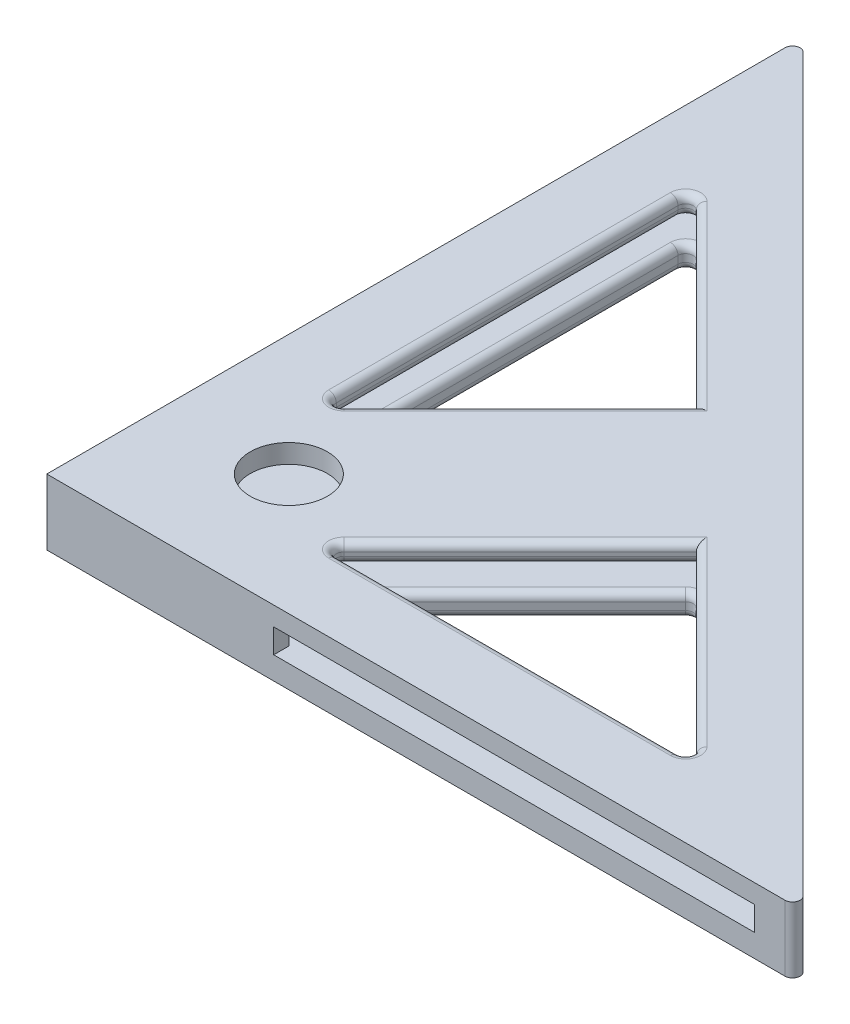
from build123d import *

# Parameters (mm, degrees)
BOSS_EXTRUDE1_DEPTH      = 3.1
BOSS_EXTRUDE2_DEPTH      = 3
BOSS_EXTRUDE4_DEPTH      = 3.2
BOSS_EXTRUDE4_DEPTH_BACK = 3
BOSS_EXTRUDE5_DEPTH      = 2.5
BOSS_EXTRUDE6_DEPTH      = 2.5
CUT_EXTRUDE1_START       = -3
SKETCH7_R                = 5.1
CUT_EXTRUDE1_DEPTH       = 10
BOSS_EXTRUDE7_DEPTH      = 3
FILLET1_R                = 1
CUT_EXTRUDE3_DEPTH       = 137.869712806
FILLET2_R                = 1
FILLET2_OF_MIRROR1_R     = 1
SKETCH20_W               = 4
SKETCH20_H               = 3.2
BOSS_EXTRUDE8_DEPTH      = 2
BOSS_EXTRUDE9_DEPTH      = 3.2
SKETCH22_W               = 4
SKETCH22_H               = 3.2
BOSS_EXTRUDE10_DEPTH     = 2
BOSS_EXTRUDE11_DEPTH     = 3.2


with BuildPart() as part:
    # Sketch1 → Boss-Extrude1 (new body)
    with BuildSketch(Plane(origin=(0, 0, 0), x_dir=(1, 0, 0), z_dir=(0, 1, 0))):
        with BuildLine():
            ThreePointArc((20.6, 14), (16.525710654, 20.097604915), (9.333095244, 18.666904756))
            Line((9.333095244, 18.666904756), (10.393755416, 17.606244584))
            ThreePointArc((10.393755416, 17.606244584), (15.951685505, 18.711785616), (19.1, 14))
            ThreePointArc((19.1, 14), (18.711785616, 12.048314495), (17.606244584, 10.393755416))
            Line((17.606244584, 10.393755416), (18.666904756, 9.333095244))
            ThreePointArc((18.666904756, 9.333095244), (20.097604915, 11.474289346), (20.6, 14))
        make_face()
        with BuildLine():
            Line((10.393755416, 17.606244584), (9.333095244, 18.666904756))
            ThreePointArc((9.333095244, 18.666904756), (9.333095244, 9.333095244), (18.666904756, 9.333095244))
            Line((18.666904756, 9.333095244), (17.606244584, 10.393755416))
            ThreePointArc((17.606244584, 10.393755416), (10.393755416, 10.393755416), (10.393755416, 17.606244584))
        make_face()
    extrude(amount=BOSS_EXTRUDE1_DEPTH)

    # Sketch2 → Boss-Extrude2 (add)
    with BuildSketch(Plane(origin=(0, 3.1, 0), x_dir=(1, 0, 0), z_dir=(0, 1, 0))):
        with BuildLine():
            Line((16.844257653, 19.955686224), (0, 28))
            Line((0, 28), (4.242424242, 23.757575758))
            Line((4.242424242, 23.757575758), (8.980990355, 21.494578276))
            Line((8.980990355, 21.494578276), (7.411542732, 20.588457268))
            Line((7.411542732, 20.588457268), (9.333095244, 18.666904756))
            ThreePointArc((9.333095244, 18.666904756), (12.883868272, 20.504940428), (16.844257653, 19.955686224))
        make_face()
        with BuildLine():
            Line((0, 28), (0, 0))
            Line((0, 0), (9.333095244, 9.333095244))
            ThreePointArc((9.333095244, 9.333095244), (7.4, 14), (9.333095244, 18.666904756))
            Line((9.333095244, 18.666904756), (7.411542732, 20.588457268))
            Line((7.411542732, 20.588457268), (4, 18.618802154))
            Line((4, 18.618802154), (4, 23.873350327))
            Line((4, 23.873350327), (4.242424242, 23.757575758))
            Line((4.242424242, 23.757575758), (0, 28))
        make_face()
        with BuildLine():
            Line((9.333095244, 9.333095244), (0, 0))
            Line((0, 0), (28, 0))
            Line((28, 0), (23.757575758, 4.242424242))
            Line((23.757575758, 4.242424242), (23.873350327, 4))
            Line((23.873350327, 4), (18.618802154, 4))
            Line((18.618802154, 4), (20.588457268, 7.411542732))
            Line((20.588457268, 7.411542732), (18.666904756, 9.333095244))
            ThreePointArc((18.666904756, 9.333095244), (14, 7.4), (9.333095244, 9.333095244))
        make_face()
        with BuildLine():
            Line((23.757575758, 4.242424242), (28, 0))
            Line((28, 0), (19.955686224, 16.844257653))
            ThreePointArc((19.955686224, 16.844257653), (20.436906442, 15.458161671), (20.6, 14))
            ThreePointArc((20.6, 14), (20.097604915, 11.474289346), (18.666904756, 9.333095244))
            Line((18.666904756, 9.333095244), (20.588457268, 7.411542732))
            Line((20.588457268, 7.411542732), (21.494578276, 8.980990355))
            Line((21.494578276, 8.980990355), (23.757575758, 4.242424242))
        make_face()
        with BuildLine():
            ThreePointArc((9.333095244, 18.666904756), (7.4, 14), (9.333095244, 9.333095244))
            Line((9.333095244, 9.333095244), (10.393755416, 10.393755416))
            ThreePointArc((10.393755416, 10.393755416), (8.9, 14), (10.393755416, 17.606244584))
            Line((10.393755416, 17.606244584), (9.333095244, 18.666904756))
        make_face()
        with BuildLine():
            Line((10.393755416, 10.393755416), (9.333095244, 9.333095244))
            ThreePointArc((9.333095244, 9.333095244), (14, 7.4), (18.666904756, 9.333095244))
            Line((18.666904756, 9.333095244), (17.606244584, 10.393755416))
            ThreePointArc((17.606244584, 10.393755416), (14, 8.9), (10.393755416, 10.393755416))
        make_face()
        with BuildLine():
            ThreePointArc((18.666904756, 18.666904756), (17.810463174, 19.388911801), (16.844257653, 19.955686224))
            ThreePointArc((16.844257653, 19.955686224), (12.883868272, 20.504940428), (9.333095244, 18.666904756))
            Line((9.333095244, 18.666904756), (10.393755416, 17.606244584))
            ThreePointArc((10.393755416, 17.606244584), (14, 19.1), (17.606244584, 17.606244584))
            Line((17.606244584, 17.606244584), (18.666904756, 18.666904756))
        make_face()
        with BuildLine():
            ThreePointArc((20.6, 14), (20.436906442, 15.458161671), (19.955686224, 16.844257653))
            ThreePointArc((19.955686224, 16.844257653), (19.388911801, 17.810463174), (18.666904756, 18.666904756))
            Line((18.666904756, 18.666904756), (17.606244584, 17.606244584))
            ThreePointArc((17.606244584, 17.606244584), (18.711785616, 15.951685505), (19.1, 14))
            ThreePointArc((19.1, 14), (18.711785616, 12.048314495), (17.606244584, 10.393755416))
            Line((17.606244584, 10.393755416), (18.666904756, 9.333095244))
            ThreePointArc((18.666904756, 9.333095244), (20.097604915, 11.474289346), (20.6, 14))
        make_face()
        with BuildLine():
            ThreePointArc((10.393755416, 17.606244584), (8.9, 14), (10.393755416, 10.393755416))
            Line((10.393755416, 10.393755416), (14, 14))
            Line((14, 14), (10.393755416, 17.606244584))
        make_face()
        with BuildLine():
            Line((14, 14), (10.393755416, 10.393755416))
            ThreePointArc((10.393755416, 10.393755416), (14, 8.9), (17.606244584, 10.393755416))
            Line((17.606244584, 10.393755416), (14, 14))
        make_face()
        with BuildLine():
            Line((17.606244584, 17.606244584), (14, 14))
            Line((14, 14), (17.606244584, 10.393755416))
            ThreePointArc((17.606244584, 10.393755416), (18.711785616, 12.048314495), (19.1, 14))
            ThreePointArc((19.1, 14), (18.711785616, 15.951685505), (17.606244584, 17.606244584))
        make_face()
        with BuildLine():
            Line((10.393755416, 17.606244584), (14, 14))
            Line((14, 14), (17.606244584, 17.606244584))
            ThreePointArc((17.606244584, 17.606244584), (14, 19.1), (10.393755416, 17.606244584))
        make_face()
    extrude(amount=BOSS_EXTRUDE2_DEPTH)

    # Sketch4 → Boss-Extrude4 (add, two sides: drawn at the far end of the back side and taken through both)
    with BuildSketch(Plane(origin=(0, 6.1, 0), x_dir=(1, 0, 0), z_dir=(0, 1, 0)).offset(-BOSS_EXTRUDE4_DEPTH_BACK)):
        Polygon((0, 28), (-2, 28), (-2, -2), (28, -2), (28, 0), (0, 0), align=None)
    extrude(amount=BOSS_EXTRUDE4_DEPTH + BOSS_EXTRUDE4_DEPTH_BACK)

    # Sketch5 → Boss-Extrude5 (add)
    with BuildSketch(Plane(origin=(0, 9.3, 0), x_dir=(1, 0, 0), z_dir=(0, 1, 0))):
        with BuildLine():
            Line((-2, 28), (0, 28))
            Line((0, 28), (15.695653699, 20.504225127))
            ThreePointArc((15.695653699, 20.504225127), (18.512471949, 18.512471949), (20.504225127, 15.695653699))
            Line((20.504225127, 15.695653699), (28, 0))
            Line((28, 0), (28, -2))
            Line((28, -2), (-2, -2))
            Line((-2, -2), (-2, 28))
        make_face()
    extrude(amount=BOSS_EXTRUDE5_DEPTH)

    # Sketch6 → Boss-Extrude6 (add)
    with BuildSketch(Plane(origin=(0, 11.8, 0), x_dir=(1, 0, 0), z_dir=(0, 1, 0))):
        Polygon((-2, -2), (-2, 98), (98, -2), align=None)
    extrude(amount=-BOSS_EXTRUDE6_DEPTH)

    # Sketch7 → Cut-Extrude1 (cut)
    with BuildSketch(Plane.XZ.offset(-3.1).offset(CUT_EXTRUDE1_START)):
        with Locations(Location((14, -14, 0), (0, 0, 270))):
            Circle(SKETCH7_R)
    extrude(amount=-CUT_EXTRUDE1_DEPTH, mode=Mode.SUBTRACT)

    # Sketch18 → Boss-Extrude7 (add)
    with BuildSketch(Plane.XZ.offset(-3.1)):
        Polygon((-2, 2), (98, 2), (-2, -98), align=None)
    extrude(amount=-BOSS_EXTRUDE7_DEPTH)

    # Fillet1
    fillet1_edges = [part.edges().sort_by_distance(p)[0] for p in [
        (-2, 4.6, -98),
        (98, 4.6, 2),
        (98, 10.55, 2),
        (-2, 10.55, -98),
    ]]
    fillet(fillet1_edges, radius=FILLET1_R)

    # Sketch19 → Cut-Extrude3 (cut, through all)
    with BuildSketch(Plane.XZ.offset(-3.1)):
        Polygon((33, -48.857864376), (8, -73.857864376), (8, -23.857864376), align=None)
    cut_extrude3 = extrude(amount=-CUT_EXTRUDE3_DEPTH, mode=Mode.SUBTRACT)

    # Fillet2
    fillet2_edges = [part.edges().sort_by_distance(p)[0] for p in [
        (20.5, 6.1, -61.357864376),
        (20.5, 3.1, -61.357864376),
        (20.5, 3.1, -36.357864376),
        (20.5, 6.1, -36.357864376),
        (20.5, 11.8, -36.357864376),
        (20.5, 11.8, -61.357864376),
        (20.5, 9.3, -61.357864376),
        (20.5, 9.3, -36.357864376),
        (8, 4.6, -73.857864376),
        (8, 3.1, -48.857864376),
        (8, 4.6, -23.857864376),
        (8, 6.1, -48.857864376),
        (8, 11.8, -48.857864376),
        (8, 10.55, -73.857864376),
        (8, 9.3, -48.857864376),
        (8, 10.55, -23.857864376),
        (33, 4.6, -48.857864376),
    ]]
    fillet(fillet2_edges, radius=FILLET2_R)

    # Mirror1: Cut-Extrude3 across plane
    add(cut_extrude3.mirror(Plane(origin=(0, 0, 0), x_dir=(-0.7071067811865475, 0, 0.7071067811865477), z_dir=(-0.7071067811865476, 0, -0.7071067811865475))), mode=Mode.SUBTRACT)

    # Fillet2 of Mirror1
    fillet2_of_mirror1_edges = [part.edges().sort_by_distance(p)[0] for p in [
        (61.357864376, 6.1, -20.5),
        (61.357864376, 3.1, -20.5),
        (36.357864376, 3.1, -20.5),
        (36.357864376, 6.1, -20.5),
        (36.357864376, 11.8, -20.5),
        (61.357864376, 11.8, -20.5),
        (61.357864376, 9.3, -20.5),
        (36.357864376, 9.3, -20.5),
        (73.857864376, 4.6, -8),
        (48.857864376, 3.1, -8),
        (23.857864376, 4.6, -8),
        (48.857864376, 6.1, -8),
        (48.857864376, 11.8, -8),
        (73.857864376, 10.55, -8),
        (48.857864376, 9.3, -8),
        (23.857864376, 10.55, -8),
        (48.857864376, 4.6, -33),
    ]]
    fillet(fillet2_of_mirror1_edges, radius=FILLET2_OF_MIRROR1_R)

    # Sketch20 → Boss-Extrude8 (add)
    with BuildSketch(Plane.ZY.offset(2)):
        with Locations((-93.585786438, 7.7)):
            Rectangle(SKETCH20_W, SKETCH20_H)
    extrude(amount=-BOSS_EXTRUDE8_DEPTH)

    # Sketch21 → Boss-Extrude9 (add)
    with BuildSketch(Plane(origin=(0, 6.1, 0), x_dir=(1, 0, 0), z_dir=(0, 1, 0))):
        with BuildLine():
            Line((-2, 95.585786438), (0, 95.585786438))
            Line((0, 95.585786438), (0, 96))
            Line((0, 96), (-0.292893219, 96.292893219))
            ThreePointArc((-0.292893219, 96.292893219), (-1.382683432, 96.50966597), (-2, 95.585786438))
        make_face()
    extrude(amount=BOSS_EXTRUDE9_DEPTH)

    # Sketch22 → Boss-Extrude10 (add)
    with BuildSketch(Plane.XY.offset(2)):
        with Locations((93.585786438, 7.7)):
            Rectangle(SKETCH22_W, SKETCH22_H)
    extrude(amount=-BOSS_EXTRUDE10_DEPTH)

    # Sketch23 → Boss-Extrude11 (add)
    with BuildSketch(Plane(origin=(0, 6.1, 0), x_dir=(1, 0, 0), z_dir=(0, 1, 0))):
        with BuildLine():
            Line((95.585786438, 0), (96, 0))
            Line((96, 0), (96.292893219, -0.292893219))
            ThreePointArc((96.292893219, -0.292893219), (96.50966597, -1.382683432), (95.585786438, -2))
            Line((95.585786438, -2), (95.585786438, 0))
        make_face()
    extrude(amount=BOSS_EXTRUDE11_DEPTH)


solid = part.part
